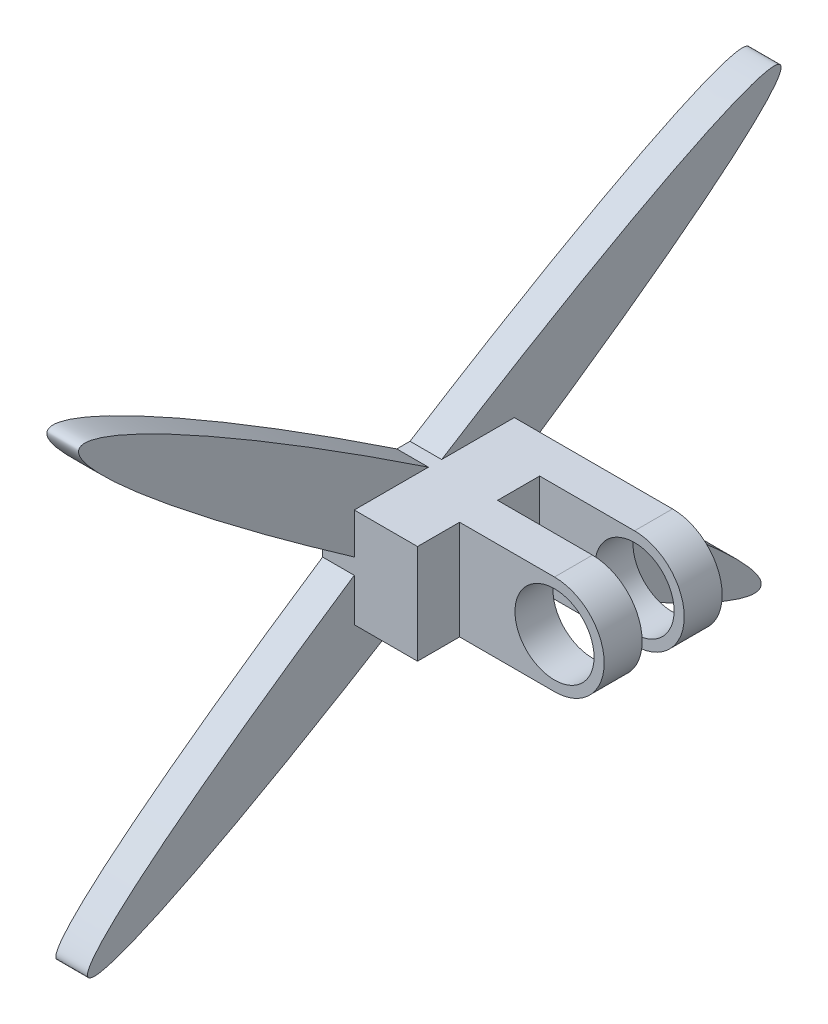
from build123d import *

# Parameters (mm, degrees)
BOSS_EXTRUDE1_DEPTH = 5
SKETCH3_W           = 25.3
SKETCH3_H           = 15.7
BOSS_EXTRUDE2_DEPTH = 40
SKETCH4_W           = 30
SKETCH4_H           = 6.65
CUT_EXTRUDE1_DEPTH  = 40
CUT_EXTRUDE2_DEPTH  = 36
SKETCH6_R           = 6.25
CUT_EXTRUDE3_DEPTH  = 35


with BuildPart() as part:
    # Sketch2 → Boss-Extrude1 (new body)
    with BuildSketch(Plane(origin=(0, 0, 0), x_dir=(0, 0, -1), z_dir=(1, 0, 0))):
        with BuildLine():
            Line((0.925790623, -7.85), (-1.163470686, -7.85))
            add(Edge.make_bspline(
                [(-12.65, -1.089934299), (-59.60717835, -32.27824179), (-54.509785656, -35.278165315), (-49.412392962, -38.27808884), (-1.163470686, -7.85)],
                knots=[1.744557509, 1.744557509, 1.744557509, 3.18830599, 3.18830599, 4.632054471, 4.632054471, 4.632054471], degree=2, weights=[1, 0.750568564, 1, 0.750568564, 1]))
            Line((-12.65, -1.089934299), (-12.65, 1.416306404))
            add(Edge.make_bspline(
                [(-0.925790623, 7.85), (-50.691554056, 41.036830942), (-55.9190987, 38.168200792), (-61.146643344, 35.299570643), (-12.65, 1.416306404)],
                knots=[4.788690115, 4.788690115, 4.788690115, 6.237798558, 6.237798558, 7.686907002, 7.686907002, 7.686907002], degree=2, weights=[1, 0.748794959, 1, 0.748794959, 1]))
            Line((-0.925790623, 7.85), (1.163470686, 7.85))
            add(Edge.make_bspline(
                [(12.65, 1.089934299), (59.60717835, 32.27824179), (54.509785656, 35.278165315), (49.412392962, 38.27808884), (1.163470686, 7.85)],
                knots=[1.744557509, 1.744557509, 1.744557509, 3.18830599, 3.18830599, 4.632054471, 4.632054471, 4.632054471], degree=2, weights=[1, 0.750568564, 1, 0.750568564, 1]))
            Line((12.65, 1.089934299), (12.65, -1.416306404))
            add(Edge.make_bspline(
                [(0.925790623, -7.85), (46.156086158, -37.879452488), (51.333566759, -35.038295126), (56.51104736, -32.197137764), (12.65, -1.416306404)],
                knots=[1.653837862, 1.653837862, 1.653837862, 3.092014654, 3.092014654, 4.530191446, 4.530191446, 4.530191446], degree=2, weights=[1, 0.752406514, 1, 0.752406514, 1]))
        make_face()
    extrude(amount=BOSS_EXTRUDE1_DEPTH)

    # Sketch3 → Boss-Extrude2 (add)
    with BuildSketch(Plane(origin=(5, 0, 0), x_dir=(0, 0, -1), z_dir=(1, 0, 0))):
        Rectangle(SKETCH3_W, SKETCH3_H)
    extrude(amount=BOSS_EXTRUDE2_DEPTH)

    # Sketch4 → Cut-Extrude1 (cut)
    with BuildSketch(Plane.XZ.offset(7.85)):
        with Locations((30, 9.325)):
            Rectangle(SKETCH4_W, SKETCH4_H)
        with Locations((30, -3.325)):
            Rectangle(SKETCH4_W, SKETCH4_H)
    extrude(amount=-CUT_EXTRUDE1_DEPTH, mode=Mode.SUBTRACT)

    # Sketch5 → Cut-Extrude2 (cut)
    with BuildSketch(Plane.XY.offset(6)):
        with BuildLine():
            Line((45, 7.85), (30, 7.85))
            ThreePointArc((30, 7.85), (37.85, 0), (30, -7.85))
            Line((30, -7.85), (45, -7.85))
            Line((45, -7.85), (45, 7.85))
        make_face()
    extrude(amount=-CUT_EXTRUDE2_DEPTH, mode=Mode.SUBTRACT)

    # Sketch6 → Cut-Extrude3 (cut)
    with BuildSketch(Plane.XY.offset(6)):
        with Locations((30, 0)):
            Circle(SKETCH6_R)
    extrude(amount=-CUT_EXTRUDE3_DEPTH, mode=Mode.SUBTRACT)


solid = part.part
